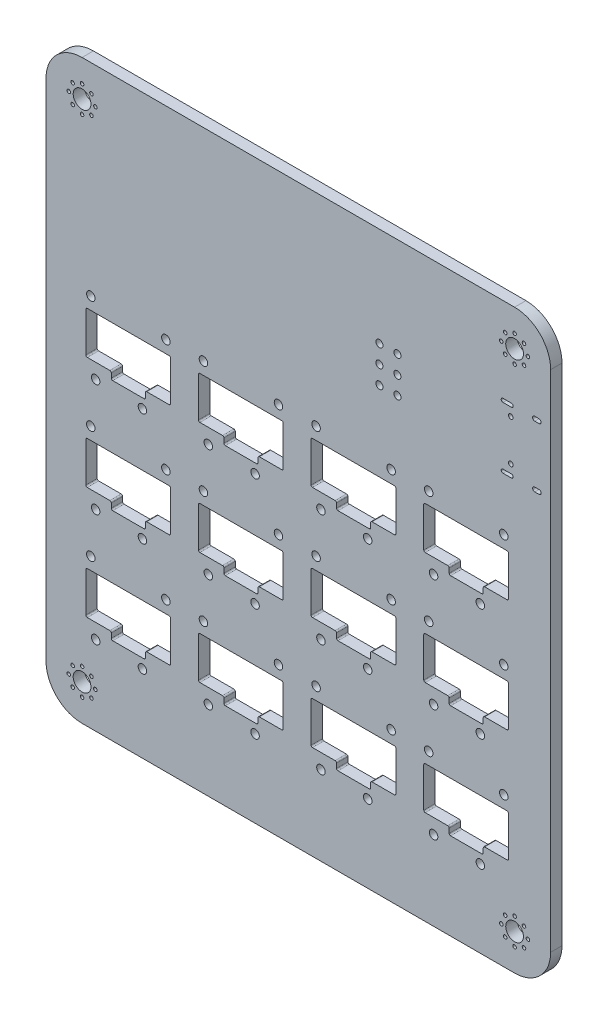
from build123d import *

# Parameters (mm, degrees)
ESQUISSE1_R        = 0.25
ESQUISSE1_R_2      = 1.25
ESQUISSE1_R_3      = 0.6
ESQUISSE1_R_4      = 0.325
ESQUISSE1_R_5      = 0.5
BOSS_EXTRU_1_DEPTH = 1.6


with BuildPart() as part:
    # Esquisse1 → Boss.-Extru.1 (new body)
    with BuildSketch(Plane.XY.offset(1.6)):
        with BuildLine():
            Line((167.005, -41.275), (167.005, -112.395))
            ThreePointArc((167.005, -112.395), (168.492897552, -115.987102448), (172.085, -117.475))
            Line((172.085, -117.475), (233.045, -117.475))
            ThreePointArc((233.045, -117.475), (236.637102448, -115.987102448), (238.125, -112.395))
            Line((238.125, -112.395), (238.125, -41.275))
            ThreePointArc((238.125, -41.275), (236.637102448, -37.682897552), (233.045, -36.195))
            Line((233.045, -36.195), (172.085, -36.195))
            ThreePointArc((172.085, -36.195), (168.492897552, -37.682897552), (167.005, -41.275))
        make_face()
        with Locations(Location((233.045, -114.27, 0), (0, 0, 180))):
            Circle(ESQUISSE1_R, mode=Mode.SUBTRACT)
        with Locations(Location((172.085, -114.27, 0), (0, 0, 180))):
            Circle(ESQUISSE1_R, mode=Mode.SUBTRACT)
        with Locations(Location((233.045, -39.4, 0), (0, 0, 180))):
            Circle(ESQUISSE1_R, mode=Mode.SUBTRACT)
        with Locations(Location((172.085, -39.4, 0), (0, 0, 180))):
            Circle(ESQUISSE1_R, mode=Mode.SUBTRACT)
        with Locations(Location((170.759175, -39.949175, 0), (0, 0, 180))):
            Circle(ESQUISSE1_R, mode=Mode.SUBTRACT)
        with Locations(Location((172.085, -41.275, 0), (0, 0, 180))):
            Circle(ESQUISSE1_R_2, mode=Mode.SUBTRACT)
        with Locations(Location((173.410825, -39.949175, 0), (0, 0, 180))):
            Circle(ESQUISSE1_R, mode=Mode.SUBTRACT)
        with Locations(Location((231.17, -41.275, 0), (0, 0, 180))):
            Circle(ESQUISSE1_R, mode=Mode.SUBTRACT)
        with Locations(Location((231.719175, -39.949175, 0), (0, 0, 180))):
            Circle(ESQUISSE1_R, mode=Mode.SUBTRACT)
        with Locations(Location((234.370825, -42.600825, 0), (0, 0, 180))):
            Circle(ESQUISSE1_R, mode=Mode.SUBTRACT)
        with Locations(Location((233.045, -41.275, 0), (0, 0, 180))):
            Circle(ESQUISSE1_R_2, mode=Mode.SUBTRACT)
        with Locations(Location((234.370825, -39.949175, 0), (0, 0, 180))):
            Circle(ESQUISSE1_R, mode=Mode.SUBTRACT)
        with Locations(Location((231.521, -64.7192, 0), (0, 0, 180))):
            Circle(ESQUISSE1_R_3, mode=Mode.SUBTRACT)
        with Locations(Location((232.505, -49.815, 0), (0, 0, 180))):
            Circle(ESQUISSE1_R_4, mode=Mode.SUBTRACT)
        with Locations(Location((233.045, -43.15, 0), (0, 0, 180))):
            Circle(ESQUISSE1_R, mode=Mode.SUBTRACT)
        with Locations(Location((234.92, -41.275, 0), (0, 0, 180))):
            Circle(ESQUISSE1_R, mode=Mode.SUBTRACT)
        with Locations(Location((231.521, -80.5942, 0), (0, 0, 180))):
            Circle(ESQUISSE1_R_3, mode=Mode.SUBTRACT)
        with Locations(Location((233.045, -110.52, 0), (0, 0, 180))):
            Circle(ESQUISSE1_R, mode=Mode.SUBTRACT)
        with Locations(Location((234.370825, -111.069175, 0), (0, 0, 180))):
            Circle(ESQUISSE1_R, mode=Mode.SUBTRACT)
        with Locations(Location((231.719175, -111.069175, 0), (0, 0, 180))):
            Circle(ESQUISSE1_R, mode=Mode.SUBTRACT)
        with Locations(Location((231.719175, -113.720825, 0), (0, 0, 180))):
            Circle(ESQUISSE1_R, mode=Mode.SUBTRACT)
        with Locations(Location((233.045, -112.395, 0), (0, 0, 180))):
            Circle(ESQUISSE1_R_2, mode=Mode.SUBTRACT)
        with Locations(Location((234.370825, -113.720825, 0), (0, 0, 180))):
            Circle(ESQUISSE1_R, mode=Mode.SUBTRACT)
        with Locations(Location((234.92, -112.395, 0), (0, 0, 180))):
            Circle(ESQUISSE1_R, mode=Mode.SUBTRACT)
        with Locations(Location((172.085, -110.52, 0), (0, 0, 180))):
            Circle(ESQUISSE1_R, mode=Mode.SUBTRACT)
        with Locations(Location((170.759175, -111.069175, 0), (0, 0, 180))):
            Circle(ESQUISSE1_R, mode=Mode.SUBTRACT)
        with Locations(Location((172.085, -112.395, 0), (0, 0, 180))):
            Circle(ESQUISSE1_R_2, mode=Mode.SUBTRACT)
        with Locations(Location((173.410825, -111.069175, 0), (0, 0, 180))):
            Circle(ESQUISSE1_R, mode=Mode.SUBTRACT)
        with Locations(Location((170.21, -112.395, 0), (0, 0, 180))):
            Circle(ESQUISSE1_R, mode=Mode.SUBTRACT)
        with Locations(Location((231.17, -112.395, 0), (0, 0, 180))):
            Circle(ESQUISSE1_R, mode=Mode.SUBTRACT)
        with Locations(Location((173.410825, -113.720825, 0), (0, 0, 180))):
            Circle(ESQUISSE1_R, mode=Mode.SUBTRACT)
        with Locations(Location((173.96, -112.395, 0), (0, 0, 180))):
            Circle(ESQUISSE1_R, mode=Mode.SUBTRACT)
        with Locations(Location((170.759175, -113.720825, 0), (0, 0, 180))):
            Circle(ESQUISSE1_R, mode=Mode.SUBTRACT)
        with Locations(Location((189.8777, -74.5363, 0), (0, 0, 180))):
            Circle(ESQUISSE1_R_3, mode=Mode.SUBTRACT)
        with Locations(Location((196.469, -74.8157, 0), (0, 0, 180))):
            Circle(ESQUISSE1_R_3, mode=Mode.SUBTRACT)
        with Locations(Location((212.344, -74.8157, 0), (0, 0, 180))):
            Circle(ESQUISSE1_R_3, mode=Mode.SUBTRACT)
        with Locations(Location((205.7527, -74.5363, 0), (0, 0, 180))):
            Circle(ESQUISSE1_R_3, mode=Mode.SUBTRACT)
        with Locations(Location((205.0669, -80.5815, 0), (0, 0, 180))):
            Circle(ESQUISSE1_R_3, mode=Mode.SUBTRACT)
        with Locations(Location((199.771, -80.5942, 0), (0, 0, 180))):
            Circle(ESQUISSE1_R_3, mode=Mode.SUBTRACT)
        with Locations(Location((215.646, -80.5942, 0), (0, 0, 180))):
            Circle(ESQUISSE1_R_3, mode=Mode.SUBTRACT)
        with Locations(Location((221.6277, -74.5363, 0), (0, 0, 180))):
            Circle(ESQUISSE1_R_3, mode=Mode.SUBTRACT)
        with Locations(Location((228.219, -74.8157, 0), (0, 0, 180))):
            Circle(ESQUISSE1_R_3, mode=Mode.SUBTRACT)
        with Locations(Location((228.219, -90.6907, 0), (0, 0, 180))):
            Circle(ESQUISSE1_R_3, mode=Mode.SUBTRACT)
        with Locations(Location((205.7527, -90.4113, 0), (0, 0, 180))):
            Circle(ESQUISSE1_R_3, mode=Mode.SUBTRACT)
        with Locations(Location((212.344, -90.6907, 0), (0, 0, 180))):
            Circle(ESQUISSE1_R_3, mode=Mode.SUBTRACT)
        with Locations(Location((221.6277, -90.4113, 0), (0, 0, 180))):
            Circle(ESQUISSE1_R_3, mode=Mode.SUBTRACT)
        with Locations(Location((196.469, -90.6907, 0), (0, 0, 180))):
            Circle(ESQUISSE1_R_3, mode=Mode.SUBTRACT)
        with Locations(Location((180.594, -90.6907, 0), (0, 0, 180))):
            Circle(ESQUISSE1_R_3, mode=Mode.SUBTRACT)
        with Locations(Location((174.0027, -90.4113, 0), (0, 0, 180))):
            Circle(ESQUISSE1_R_3, mode=Mode.SUBTRACT)
        with Locations(Location((189.8777, -90.4113, 0), (0, 0, 180))):
            Circle(ESQUISSE1_R_3, mode=Mode.SUBTRACT)
        with Locations(Location((215.646, -96.4692, 0), (0, 0, 180))):
            Circle(ESQUISSE1_R_3, mode=Mode.SUBTRACT)
        with Locations(Location((205.0669, -96.4565, 0), (0, 0, 180))):
            Circle(ESQUISSE1_R_3, mode=Mode.SUBTRACT)
        with Locations(Location((220.9419, -96.4565, 0), (0, 0, 180))):
            Circle(ESQUISSE1_R_3, mode=Mode.SUBTRACT)
        with Locations(Location((231.521, -96.4692, 0), (0, 0, 180))):
            Circle(ESQUISSE1_R_3, mode=Mode.SUBTRACT)
        with Locations(Location((199.771, -96.4692, 0), (0, 0, 180))):
            Circle(ESQUISSE1_R_3, mode=Mode.SUBTRACT)
        with Locations(Location((173.3169, -96.4565, 0), (0, 0, 180))):
            Circle(ESQUISSE1_R_3, mode=Mode.SUBTRACT)
        with Locations(Location((189.1919, -96.4565, 0), (0, 0, 180))):
            Circle(ESQUISSE1_R_3, mode=Mode.SUBTRACT)
        with Locations(Location((183.896, -96.4692, 0), (0, 0, 180))):
            Circle(ESQUISSE1_R_3, mode=Mode.SUBTRACT)
        with Locations(Location((189.8777, -106.2863, 0), (0, 0, 180))):
            Circle(ESQUISSE1_R_3, mode=Mode.SUBTRACT)
        with Locations(Location((196.469, -106.5657, 0), (0, 0, 180))):
            Circle(ESQUISSE1_R_3, mode=Mode.SUBTRACT)
        with Locations(Location((180.594, -106.5657, 0), (0, 0, 180))):
            Circle(ESQUISSE1_R_3, mode=Mode.SUBTRACT)
        with Locations(Location((174.0027, -106.2863, 0), (0, 0, 180))):
            Circle(ESQUISSE1_R_3, mode=Mode.SUBTRACT)
        with Locations(Location((212.344, -106.5657, 0), (0, 0, 180))):
            Circle(ESQUISSE1_R_3, mode=Mode.SUBTRACT)
        with Locations(Location((205.7527, -106.2863, 0), (0, 0, 180))):
            Circle(ESQUISSE1_R_3, mode=Mode.SUBTRACT)
        with Locations(Location((221.6277, -106.2863, 0), (0, 0, 180))):
            Circle(ESQUISSE1_R_3, mode=Mode.SUBTRACT)
        with Locations(Location((228.219, -106.5657, 0), (0, 0, 180))):
            Circle(ESQUISSE1_R_3, mode=Mode.SUBTRACT)
        with Locations(Location((232.505, -55.595, 0), (0, 0, 180))):
            Circle(ESQUISSE1_R_4, mode=Mode.SUBTRACT)
        with Locations(Location((231.719175, -42.600825, 0), (0, 0, 180))):
            Circle(ESQUISSE1_R, mode=Mode.SUBTRACT)
        with Locations(Location((220.9419, -64.7065, 0), (0, 0, 180))):
            Circle(ESQUISSE1_R_3, mode=Mode.SUBTRACT)
        with Locations(Location((220.9419, -80.5815, 0), (0, 0, 180))):
            Circle(ESQUISSE1_R_3, mode=Mode.SUBTRACT)
        with Locations(Location((173.410825, -42.600825, 0), (0, 0, 180))):
            Circle(ESQUISSE1_R, mode=Mode.SUBTRACT)
        with Locations(Location((173.96, -41.275, 0), (0, 0, 180))):
            Circle(ESQUISSE1_R, mode=Mode.SUBTRACT)
        with Locations(Location((172.085, -43.15, 0), (0, 0, 180))):
            Circle(ESQUISSE1_R, mode=Mode.SUBTRACT)
        with Locations(Location((170.759175, -42.600825, 0), (0, 0, 180))):
            Circle(ESQUISSE1_R, mode=Mode.SUBTRACT)
        with Locations(Location((170.21, -41.275, 0), (0, 0, 180))):
            Circle(ESQUISSE1_R, mode=Mode.SUBTRACT)
        with Locations(Location((213.995, -52.705, 0), (0, 0, 180))):
            Circle(ESQUISSE1_R_5, mode=Mode.SUBTRACT)
        with Locations(Location((216.535, -52.705, 0), (0, 0, 180))):
            Circle(ESQUISSE1_R_5, mode=Mode.SUBTRACT)
        with Locations(Location((213.995, -50.165, 0), (0, 0, 180))):
            Circle(ESQUISSE1_R_5, mode=Mode.SUBTRACT)
        with Locations(Location((216.535, -50.165, 0), (0, 0, 180))):
            Circle(ESQUISSE1_R_5, mode=Mode.SUBTRACT)
        with Locations(Location((205.0669, -64.7065, 0), (0, 0, 180))):
            Circle(ESQUISSE1_R_3, mode=Mode.SUBTRACT)
        with Locations(Location((215.646, -64.7192, 0), (0, 0, 180))):
            Circle(ESQUISSE1_R_3, mode=Mode.SUBTRACT)
        with Locations(Location((213.995, -55.245, 0), (0, 0, 180))):
            Circle(ESQUISSE1_R_5, mode=Mode.SUBTRACT)
        with Locations(Location((216.535, -55.245, 0), (0, 0, 180))):
            Circle(ESQUISSE1_R_5, mode=Mode.SUBTRACT)
        with Locations(Location((199.771, -64.7192, 0), (0, 0, 180))):
            Circle(ESQUISSE1_R_3, mode=Mode.SUBTRACT)
        with Locations(Location((189.1919, -64.7065, 0), (0, 0, 180))):
            Circle(ESQUISSE1_R_3, mode=Mode.SUBTRACT)
        with Locations(Location((189.1919, -80.5815, 0), (0, 0, 180))):
            Circle(ESQUISSE1_R_3, mode=Mode.SUBTRACT)
        with Locations(Location((183.896, -64.7192, 0), (0, 0, 180))):
            Circle(ESQUISSE1_R_3, mode=Mode.SUBTRACT)
        with Locations(Location((173.3169, -64.7065, 0), (0, 0, 180))):
            Circle(ESQUISSE1_R_3, mode=Mode.SUBTRACT)
        with Locations(Location((174.0027, -74.5363, 0), (0, 0, 180))):
            Circle(ESQUISSE1_R_3, mode=Mode.SUBTRACT)
        with Locations(Location((180.594, -74.8157, 0), (0, 0, 180))):
            Circle(ESQUISSE1_R_3, mode=Mode.SUBTRACT)
        with Locations(Location((183.896, -80.5942, 0), (0, 0, 180))):
            Circle(ESQUISSE1_R_3, mode=Mode.SUBTRACT)
        with Locations(Location((173.3169, -80.5815, 0), (0, 0, 180))):
            Circle(ESQUISSE1_R_3, mode=Mode.SUBTRACT)
        with BuildLine():
            Line((236.485, -57.325), (235.885, -57.325))
            ThreePointArc((235.885, -57.325), (235.585, -57.025), (235.885, -56.725))
            Line((235.885, -56.725), (236.485, -56.725))
            ThreePointArc((236.485, -56.725), (236.785, -57.025), (236.485, -57.325))
        make_face(mode=Mode.SUBTRACT)
        with BuildLine():
            Line((235.885, -48.085), (236.485, -48.085))
            ThreePointArc((236.485, -48.085), (236.785, -48.385), (236.485, -48.685))
            Line((236.485, -48.685), (235.885, -48.685))
            ThreePointArc((235.885, -48.685), (235.585, -48.385), (235.885, -48.085))
        make_face(mode=Mode.SUBTRACT)
        with BuildLine():
            Line((231.405, -56.775), (232.605, -56.775))
            ThreePointArc((232.605, -56.775), (232.855, -57.025), (232.605, -57.275))
            Line((232.605, -57.275), (231.405, -57.275))
            ThreePointArc((231.405, -57.275), (231.155, -57.025), (231.405, -56.775))
        make_face(mode=Mode.SUBTRACT)
        with BuildLine():
            Line((232.605, -48.635), (231.405, -48.635))
            ThreePointArc((231.405, -48.635), (231.155, -48.385), (231.405, -48.135))
            Line((231.405, -48.135), (232.605, -48.135))
            ThreePointArc((232.605, -48.135), (232.855, -48.385), (232.605, -48.635))
        make_face(mode=Mode.SUBTRACT)
        with BuildLine():
            Line((223.828, -89.154), (223.828, -88.511903))
            ThreePointArc((223.828, -88.511903), (223.769421356, -88.370481644), (223.628, -88.311903))
            Line((223.628, -88.311903), (220.442059, -88.311903))
            ThreePointArc((220.442059, -88.311903), (220.300637644, -88.253324356), (220.242059, -88.111903))
            Line((220.242059, -88.111903), (220.242059, -82.528232))
            ThreePointArc((220.242059, -82.528232), (220.300637644, -82.386810644), (220.442059, -82.328232))
            Line((220.442059, -82.328232), (231.981518, -82.328232))
            ThreePointArc((231.981518, -82.328232), (232.122939356, -82.386810644), (232.181518, -82.528232))
            Line((232.181518, -82.528232), (232.181518, -88.111903))
            ThreePointArc((232.181518, -88.111903), (232.122939356, -88.253324356), (231.981518, -88.311903))
            Line((231.981518, -88.311903), (228.82831, -88.311903))
            ThreePointArc((228.82831, -88.311903), (228.686888644, -88.370481644), (228.62831, -88.511903))
            Line((228.62831, -88.511903), (228.62831, -89.154))
            ThreePointArc((228.62831, -89.154), (228.569731356, -89.295421356), (228.42831, -89.354))
            Line((228.42831, -89.354), (224.028, -89.354))
            ThreePointArc((224.028, -89.354), (223.886578644, -89.295421356), (223.828, -89.154))
        make_face(mode=Mode.SUBTRACT)
        with BuildLine():
            Line((180.80331, -89.354), (176.403, -89.354))
            ThreePointArc((176.403, -89.354), (176.261578644, -89.295421356), (176.203, -89.154))
            Line((176.203, -89.154), (176.203, -88.511903))
            ThreePointArc((176.203, -88.511903), (176.144421356, -88.370481644), (176.003, -88.311903))
            Line((176.003, -88.311903), (172.817059, -88.311903))
            ThreePointArc((172.817059, -88.311903), (172.675637644, -88.253324356), (172.617059, -88.111903))
            Line((172.617059, -88.111903), (172.617059, -82.528232))
            ThreePointArc((172.617059, -82.528232), (172.675637644, -82.386810644), (172.817059, -82.328232))
            Line((172.817059, -82.328232), (184.356518, -82.328232))
            ThreePointArc((184.356518, -82.328232), (184.497939356, -82.386810644), (184.556518, -82.528232))
            Line((184.556518, -82.528232), (184.556518, -88.111903))
            ThreePointArc((184.556518, -88.111903), (184.497939356, -88.253324356), (184.356518, -88.311903))
            Line((184.356518, -88.311903), (181.20331, -88.311903))
            ThreePointArc((181.20331, -88.311903), (181.061888644, -88.370481644), (181.00331, -88.511903))
            Line((181.00331, -88.511903), (181.00331, -89.154))
            ThreePointArc((181.00331, -89.154), (180.944731356, -89.295421356), (180.80331, -89.354))
        make_face(mode=Mode.SUBTRACT)
        with BuildLine():
            Line((200.231518, -88.311903), (197.07831, -88.311903))
            ThreePointArc((197.07831, -88.311903), (196.936888644, -88.370481644), (196.87831, -88.511903))
            Line((196.87831, -88.511903), (196.87831, -89.154))
            ThreePointArc((196.87831, -89.154), (196.819731356, -89.295421356), (196.67831, -89.354))
            Line((196.67831, -89.354), (192.278, -89.354))
            ThreePointArc((192.278, -89.354), (192.136578644, -89.295421356), (192.078, -89.154))
            Line((192.078, -89.154), (192.078, -88.511903))
            ThreePointArc((192.078, -88.511903), (192.019421356, -88.370481644), (191.878, -88.311903))
            Line((191.878, -88.311903), (188.692059, -88.311903))
            ThreePointArc((188.692059, -88.311903), (188.550637644, -88.253324356), (188.492059, -88.111903))
            Line((188.492059, -88.111903), (188.492059, -82.528232))
            ThreePointArc((188.492059, -82.528232), (188.550637644, -82.386810644), (188.692059, -82.328232))
            Line((188.692059, -82.328232), (200.231518, -82.328232))
            ThreePointArc((200.231518, -82.328232), (200.372939356, -82.386810644), (200.431518, -82.528232))
            Line((200.431518, -82.528232), (200.431518, -88.111903))
            ThreePointArc((200.431518, -88.111903), (200.372939356, -88.253324356), (200.231518, -88.311903))
        make_face(mode=Mode.SUBTRACT)
        with BuildLine():
            Line((216.306518, -82.528232), (216.306518, -88.111903))
            ThreePointArc((216.306518, -88.111903), (216.247939356, -88.253324356), (216.106518, -88.311903))
            Line((216.106518, -88.311903), (212.95331, -88.311903))
            ThreePointArc((212.95331, -88.311903), (212.811888644, -88.370481644), (212.75331, -88.511903))
            Line((212.75331, -88.511903), (212.75331, -89.154))
            ThreePointArc((212.75331, -89.154), (212.694731356, -89.295421356), (212.55331, -89.354))
            Line((212.55331, -89.354), (208.153, -89.354))
            ThreePointArc((208.153, -89.354), (208.011578644, -89.295421356), (207.953, -89.154))
            Line((207.953, -89.154), (207.953, -88.511903))
            ThreePointArc((207.953, -88.511903), (207.894421356, -88.370481644), (207.753, -88.311903))
            Line((207.753, -88.311903), (204.567059, -88.311903))
            ThreePointArc((204.567059, -88.311903), (204.425637644, -88.253324356), (204.367059, -88.111903))
            Line((204.367059, -88.111903), (204.367059, -82.528232))
            ThreePointArc((204.367059, -82.528232), (204.425637644, -82.386810644), (204.567059, -82.328232))
            Line((204.567059, -82.328232), (216.106518, -82.328232))
            ThreePointArc((216.106518, -82.328232), (216.247939356, -82.386810644), (216.306518, -82.528232))
        make_face(mode=Mode.SUBTRACT)
        with BuildLine():
            Line((216.306518, -98.403232), (216.306518, -103.986903))
            ThreePointArc((216.306518, -103.986903), (216.247939356, -104.128324356), (216.106518, -104.186903))
            Line((216.106518, -104.186903), (212.95331, -104.186903))
            ThreePointArc((212.95331, -104.186903), (212.811888644, -104.245481644), (212.75331, -104.386903))
            Line((212.75331, -104.386903), (212.75331, -105.029))
            ThreePointArc((212.75331, -105.029), (212.694731356, -105.170421356), (212.55331, -105.229))
            Line((212.55331, -105.229), (208.153, -105.229))
            ThreePointArc((208.153, -105.229), (208.011578644, -105.170421356), (207.953, -105.029))
            Line((207.953, -105.029), (207.953, -104.386903))
            ThreePointArc((207.953, -104.386903), (207.894421356, -104.245481644), (207.753, -104.186903))
            Line((207.753, -104.186903), (204.567059, -104.186903))
            ThreePointArc((204.567059, -104.186903), (204.425637644, -104.128324356), (204.367059, -103.986903))
            Line((204.367059, -103.986903), (204.367059, -98.403232))
            ThreePointArc((204.367059, -98.403232), (204.425637644, -98.261810644), (204.567059, -98.203232))
            Line((204.567059, -98.203232), (216.106518, -98.203232))
            ThreePointArc((216.106518, -98.203232), (216.247939356, -98.261810644), (216.306518, -98.403232))
        make_face(mode=Mode.SUBTRACT)
        with BuildLine():
            Line((220.442059, -98.203232), (231.981518, -98.203232))
            ThreePointArc((231.981518, -98.203232), (232.122939356, -98.261810644), (232.181518, -98.403232))
            Line((232.181518, -98.403232), (232.181518, -103.986903))
            ThreePointArc((232.181518, -103.986903), (232.122939356, -104.128324356), (231.981518, -104.186903))
            Line((231.981518, -104.186903), (228.82831, -104.186903))
            ThreePointArc((228.82831, -104.186903), (228.686888644, -104.245481644), (228.62831, -104.386903))
            Line((228.62831, -104.386903), (228.62831, -105.029))
            ThreePointArc((228.62831, -105.029), (228.569731356, -105.170421356), (228.42831, -105.229))
            Line((228.42831, -105.229), (224.028, -105.229))
            ThreePointArc((224.028, -105.229), (223.886578644, -105.170421356), (223.828, -105.029))
            Line((223.828, -105.029), (223.828, -104.386903))
            ThreePointArc((223.828, -104.386903), (223.769421356, -104.245481644), (223.628, -104.186903))
            Line((223.628, -104.186903), (220.442059, -104.186903))
            ThreePointArc((220.442059, -104.186903), (220.300637644, -104.128324356), (220.242059, -103.986903))
            Line((220.242059, -103.986903), (220.242059, -98.403232))
            ThreePointArc((220.242059, -98.403232), (220.300637644, -98.261810644), (220.442059, -98.203232))
        make_face(mode=Mode.SUBTRACT)
        with BuildLine():
            Line((184.356518, -104.186903), (181.20331, -104.186903))
            ThreePointArc((181.20331, -104.186903), (181.061888644, -104.245481644), (181.00331, -104.386903))
            Line((181.00331, -104.386903), (181.00331, -105.029))
            ThreePointArc((181.00331, -105.029), (180.944731356, -105.170421356), (180.80331, -105.229))
            Line((180.80331, -105.229), (176.403, -105.229))
            ThreePointArc((176.403, -105.229), (176.261578644, -105.170421356), (176.203, -105.029))
            Line((176.203, -105.029), (176.203, -104.386903))
            ThreePointArc((176.203, -104.386903), (176.144421356, -104.245481644), (176.003, -104.186903))
            Line((176.003, -104.186903), (172.817059, -104.186903))
            ThreePointArc((172.817059, -104.186903), (172.675637644, -104.128324356), (172.617059, -103.986903))
            Line((172.617059, -103.986903), (172.617059, -98.403232))
            ThreePointArc((172.617059, -98.403232), (172.675637644, -98.261810644), (172.817059, -98.203232))
            Line((172.817059, -98.203232), (184.356518, -98.203232))
            ThreePointArc((184.356518, -98.203232), (184.497939356, -98.261810644), (184.556518, -98.403232))
            Line((184.556518, -98.403232), (184.556518, -103.986903))
            ThreePointArc((184.556518, -103.986903), (184.497939356, -104.128324356), (184.356518, -104.186903))
        make_face(mode=Mode.SUBTRACT)
        with BuildLine():
            Line((192.078, -105.029), (192.078, -104.386903))
            ThreePointArc((192.078, -104.386903), (192.019421356, -104.245481644), (191.878, -104.186903))
            Line((191.878, -104.186903), (188.692059, -104.186903))
            ThreePointArc((188.692059, -104.186903), (188.550637644, -104.128324356), (188.492059, -103.986903))
            Line((188.492059, -103.986903), (188.492059, -98.403232))
            ThreePointArc((188.492059, -98.403232), (188.550637644, -98.261810644), (188.692059, -98.203232))
            Line((188.692059, -98.203232), (200.231518, -98.203232))
            ThreePointArc((200.231518, -98.203232), (200.372939356, -98.261810644), (200.431518, -98.403232))
            Line((200.431518, -98.403232), (200.431518, -103.986903))
            ThreePointArc((200.431518, -103.986903), (200.372939356, -104.128324356), (200.231518, -104.186903))
            Line((200.231518, -104.186903), (197.07831, -104.186903))
            ThreePointArc((197.07831, -104.186903), (196.936888644, -104.245481644), (196.87831, -104.386903))
            Line((196.87831, -104.386903), (196.87831, -105.029))
            ThreePointArc((196.87831, -105.029), (196.819731356, -105.170421356), (196.67831, -105.229))
            Line((196.67831, -105.229), (192.278, -105.229))
            ThreePointArc((192.278, -105.229), (192.136578644, -105.170421356), (192.078, -105.029))
        make_face(mode=Mode.SUBTRACT)
        with BuildLine():
            Line((220.242059, -72.236903), (220.242059, -66.653232))
            ThreePointArc((220.242059, -66.653232), (220.300637644, -66.511810644), (220.442059, -66.453232))
            Line((220.442059, -66.453232), (231.981518, -66.453232))
            ThreePointArc((231.981518, -66.453232), (232.122939356, -66.511810644), (232.181518, -66.653232))
            Line((232.181518, -66.653232), (232.181518, -72.236903))
            ThreePointArc((232.181518, -72.236903), (232.122939356, -72.378324356), (231.981518, -72.436903))
            Line((231.981518, -72.436903), (228.82831, -72.436903))
            ThreePointArc((228.82831, -72.436903), (228.686888644, -72.495481644), (228.62831, -72.636903))
            Line((228.62831, -72.636903), (228.62831, -73.279))
            ThreePointArc((228.62831, -73.279), (228.569731356, -73.420421356), (228.42831, -73.479))
            Line((228.42831, -73.479), (224.028, -73.479))
            ThreePointArc((224.028, -73.479), (223.886578644, -73.420421356), (223.828, -73.279))
            Line((223.828, -73.279), (223.828, -72.636903))
            ThreePointArc((223.828, -72.636903), (223.769421356, -72.495481644), (223.628, -72.436903))
            Line((223.628, -72.436903), (220.442059, -72.436903))
            ThreePointArc((220.442059, -72.436903), (220.300637644, -72.378324356), (220.242059, -72.236903))
        make_face(mode=Mode.SUBTRACT)
        with BuildLine():
            Line((207.953, -73.279), (207.953, -72.636903))
            ThreePointArc((207.953, -72.636903), (207.894421356, -72.495481644), (207.753, -72.436903))
            Line((207.753, -72.436903), (204.567059, -72.436903))
            ThreePointArc((204.567059, -72.436903), (204.425637644, -72.378324356), (204.367059, -72.236903))
            Line((204.367059, -72.236903), (204.367059, -66.653232))
            ThreePointArc((204.367059, -66.653232), (204.425637644, -66.511810644), (204.567059, -66.453232))
            Line((204.567059, -66.453232), (216.106518, -66.453232))
            ThreePointArc((216.106518, -66.453232), (216.247939356, -66.511810644), (216.306518, -66.653232))
            Line((216.306518, -66.653232), (216.306518, -72.236903))
            ThreePointArc((216.306518, -72.236903), (216.247939356, -72.378324356), (216.106518, -72.436903))
            Line((216.106518, -72.436903), (212.95331, -72.436903))
            ThreePointArc((212.95331, -72.436903), (212.811888644, -72.495481644), (212.75331, -72.636903))
            Line((212.75331, -72.636903), (212.75331, -73.279))
            ThreePointArc((212.75331, -73.279), (212.694731356, -73.420421356), (212.55331, -73.479))
            Line((212.55331, -73.479), (208.153, -73.479))
            ThreePointArc((208.153, -73.479), (208.011578644, -73.420421356), (207.953, -73.279))
        make_face(mode=Mode.SUBTRACT)
        with BuildLine():
            Line((200.431518, -66.653232), (200.431518, -72.236903))
            ThreePointArc((200.431518, -72.236903), (200.372939356, -72.378324356), (200.231518, -72.436903))
            Line((200.231518, -72.436903), (197.07831, -72.436903))
            ThreePointArc((197.07831, -72.436903), (196.936888644, -72.495481644), (196.87831, -72.636903))
            Line((196.87831, -72.636903), (196.87831, -73.279))
            ThreePointArc((196.87831, -73.279), (196.819731356, -73.420421356), (196.67831, -73.479))
            Line((196.67831, -73.479), (192.278, -73.479))
            ThreePointArc((192.278, -73.479), (192.136578644, -73.420421356), (192.078, -73.279))
            Line((192.078, -73.279), (192.078, -72.636903))
            ThreePointArc((192.078, -72.636903), (192.019421356, -72.495481644), (191.878, -72.436903))
            Line((191.878, -72.436903), (188.692059, -72.436903))
            ThreePointArc((188.692059, -72.436903), (188.550637644, -72.378324356), (188.492059, -72.236903))
            Line((188.492059, -72.236903), (188.492059, -66.653232))
            ThreePointArc((188.492059, -66.653232), (188.550637644, -66.511810644), (188.692059, -66.453232))
            Line((188.692059, -66.453232), (200.231518, -66.453232))
            ThreePointArc((200.231518, -66.453232), (200.372939356, -66.511810644), (200.431518, -66.653232))
        make_face(mode=Mode.SUBTRACT)
        with BuildLine():
            Line((184.356518, -72.436903), (181.20331, -72.436903))
            ThreePointArc((181.20331, -72.436903), (181.061888644, -72.495481644), (181.00331, -72.636903))
            Line((181.00331, -72.636903), (181.00331, -73.279))
            ThreePointArc((181.00331, -73.279), (180.944731356, -73.420421356), (180.80331, -73.479))
            Line((180.80331, -73.479), (176.403, -73.479))
            ThreePointArc((176.403, -73.479), (176.261578644, -73.420421356), (176.203, -73.279))
            Line((176.203, -73.279), (176.203, -72.636903))
            ThreePointArc((176.203, -72.636903), (176.144421356, -72.495481644), (176.003, -72.436903))
            Line((176.003, -72.436903), (172.817059, -72.436903))
            ThreePointArc((172.817059, -72.436903), (172.675637644, -72.378324356), (172.617059, -72.236903))
            Line((172.617059, -72.236903), (172.617059, -66.653232))
            ThreePointArc((172.617059, -66.653232), (172.675637644, -66.511810644), (172.817059, -66.453232))
            Line((172.817059, -66.453232), (184.356518, -66.453232))
            ThreePointArc((184.356518, -66.453232), (184.497939356, -66.511810644), (184.556518, -66.653232))
            Line((184.556518, -66.653232), (184.556518, -72.236903))
            ThreePointArc((184.556518, -72.236903), (184.497939356, -72.378324356), (184.356518, -72.436903))
        make_face(mode=Mode.SUBTRACT)
    extrude(amount=-BOSS_EXTRU_1_DEPTH)


solid = part.part
